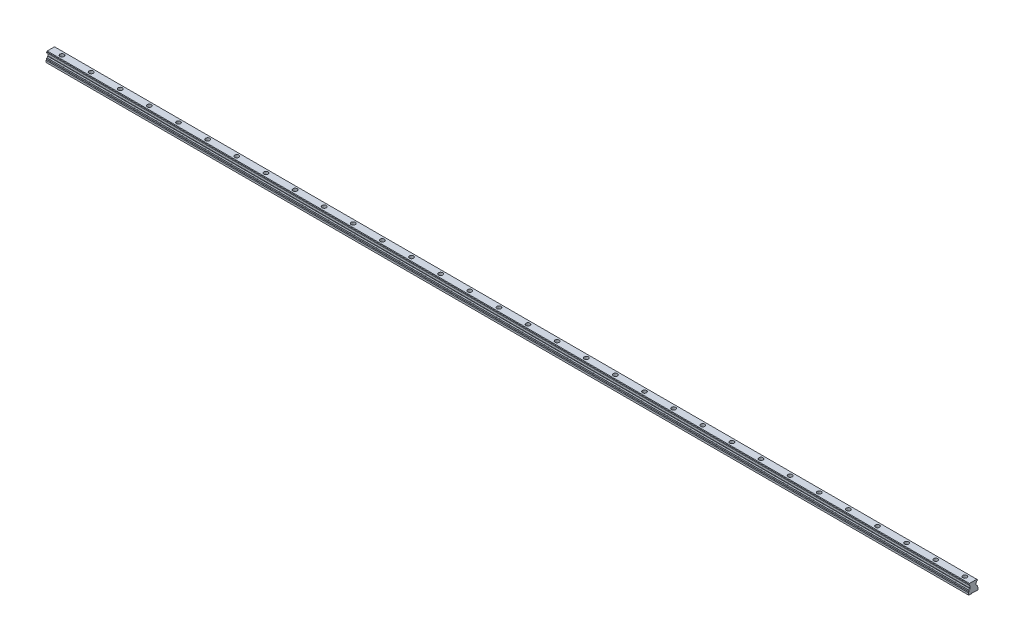
from build123d import *

# Parameters (mm, degrees)
BOSS_EXTRUDE5_DEPTH = 1900
SKETCH8_R           = 4.25
CUT_EXTRUDE1_DEPTH  = 9
SKETCH9_R           = 3
CUT_EXTRUDE2_DEPTH  = 1959.558127807
LPATTERN1_COUNT     = 35
LPATTERN1_PITCH     = 60


with BuildPart() as part:
    # Sketch7 → Boss-Extrude5 (new body)
    with BuildSketch(Plane(origin=(58.5, 0, 0), x_dir=(0, 0, -1), z_dir=(1, 0, 0))):
        with BuildLine():
            Line((-7.709038211, 8.883084864), (-8.5, 8.601077183))
            Line((-8.5, 8.601077183), (-8.5, 6.104700538))
            ThreePointArc((-8.5, 6.104700538), (-8.566987298, 5.854700538), (-8.75, 5.671687836))
            Line((-8.75, 5.671687836), (-10, 4.95))
            Line((-10, 4.95), (-10, 1))
            Line((-10, 1), (-9, 0))
            Line((-9, 0), (-4, 0))
            Line((-4, 0), (-3.5, 0.5))
            Line((-3.5, 0.5), (3.5, 0.5))
            Line((3.5, 0.5), (4, 0))
            Line((4, 0), (9, 0))
            Line((9, 0), (10, 1))
            Line((10, 1), (10, 4.95))
            Line((10, 4.95), (8.75, 5.671687836))
            ThreePointArc((8.75, 5.671687836), (8.566987298, 5.854700538), (8.5, 6.104700538))
            Line((8.5, 6.104700538), (8.5, 8.46691323))
            Line((8.5, 8.46691323), (8.084678947, 8.882234283))
            ThreePointArc((8.084678947, 8.882234283), (6.941822875, 9.249266637), (6.503340774, 10.366659226))
            Line((6.503340774, 10.366659226), (6, 10.87))
            Line((6, 10.87), (6, 14.93))
            Line((6, 14.93), (6.503340774, 15.433340774))
            ThreePointArc((6.503340774, 15.433340774), (6.813545517, 16.412959034), (7.709038211, 16.916915136))
            Line((7.709038211, 16.916915136), (8.5, 17.198922817))
            Line((8.5, 17.198922817), (8.5, 19.3))
            Line((8.5, 19.3), (7.5, 20.3))
            Line((7.5, 20.3), (-7.5, 20.3))
            Line((-7.5, 20.3), (-8.5, 19.3))
            Line((-8.5, 19.3), (-8.5, 17.33308677))
            Line((-8.5, 17.33308677), (-8.084678947, 16.917765717))
            ThreePointArc((-8.084678947, 16.917765717), (-6.941822875, 16.550733363), (-6.503340774, 15.433340774))
            Line((-6.503340774, 15.433340774), (-6, 14.93))
            Line((-6, 14.93), (-6, 10.87))
            Line((-6, 10.87), (-6.503340774, 10.366659226))
            ThreePointArc((-6.503340774, 10.366659226), (-6.813545517, 9.387040966), (-7.709038211, 8.883084864))
        make_face()
    extrude(amount=BOSS_EXTRUDE5_DEPTH)

    # Sketch8 → Cut-Extrude1 (cut)
    with BuildSketch(Plane(origin=(0, 20.3, 0), x_dir=(1, 0, 0), z_dir=(0, 1, 0))):
        with Locations(Location((1941.491679108, 0, 0), (0, 0, 270))):
            Circle(SKETCH8_R)
    cut_extrude1 = extrude(amount=-CUT_EXTRUDE1_DEPTH, mode=Mode.SUBTRACT)

    # Sketch9 → Cut-Extrude2 (cut, through all)
    with BuildSketch(Plane(origin=(0, 11.3, 0), x_dir=(1, 0, 0), z_dir=(0, 1, 0))):
        with Locations(Location((1941.491679108, 0, 0), (0, 0, 270))):
            Circle(SKETCH9_R)
    cut_extrude2 = extrude(amount=-CUT_EXTRUDE2_DEPTH, mode=Mode.SUBTRACT)

    # LPattern1: Cut-Extrude1, Cut-Extrude2 ×35
    with Locations(*[(-i * LPATTERN1_PITCH, 0, 0) for i in range(1, LPATTERN1_COUNT)]):
        add(cut_extrude1, mode=Mode.SUBTRACT)
        add(cut_extrude2, mode=Mode.SUBTRACT)


solid = part.part
